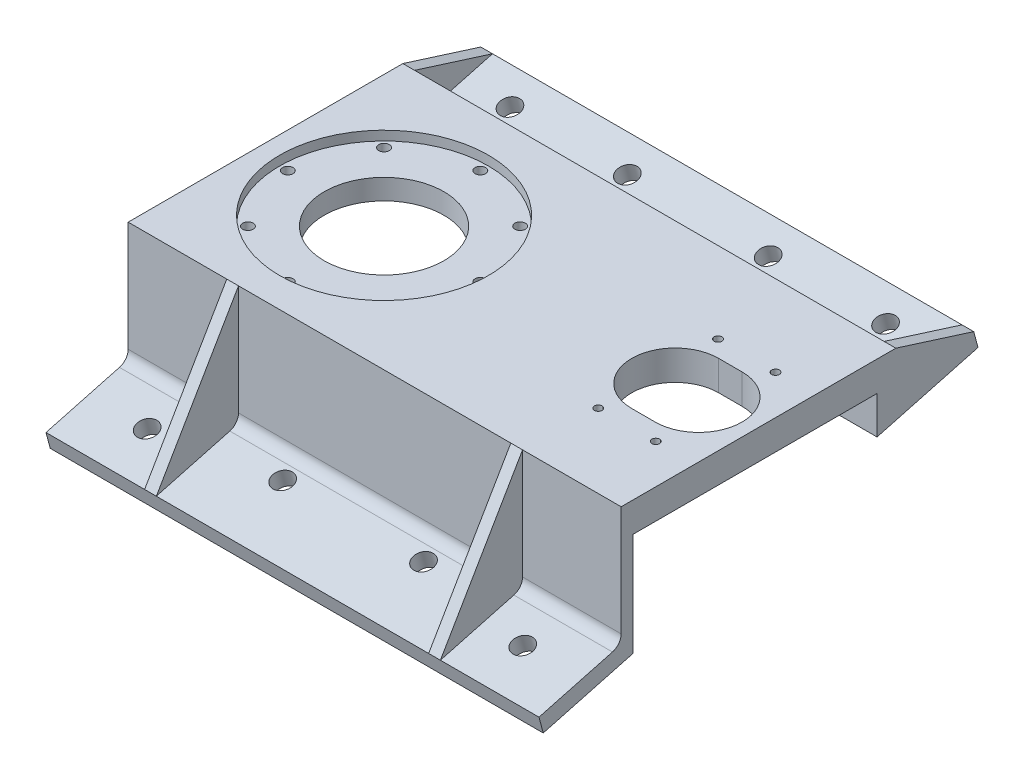
from build123d import *

# Parameters (mm, degrees)
EXTRUDE_1_DEPTH      = 30
SKETCH_2_R           = 44.45
CUT_EXTRUDE_1_DEPTH  = 4
SKETCH_3_R           = 25.5
SKETCH_3_R_2         = 2.25
CUT_EXTRUDE_2_DEPTH  = 188.619295383
CUT_EXTRUDE_3_DEPTH  = 189.215302247
SKETCH_5_R           = 1.65
CUT_EXTRUDE_4_DEPTH  = 189.215302247
EXTRUDE_START        = -30
EXTRUDE_2_DEPTH      = 30
CUT_EXTRUDE_5_DEPTH  = 198.040604952
CUT_EXTRUDE_7_DEPTH  = 233.432785983
CUT_EXTRUDE_8_DEPTH  = 233.432785983
CUT_EXTRUDE_9_DEPTH  = 233.432785983
FILLET_1_R           = 5
CUT_EXTRUDE_10_DEPTH = 233.432785983
EXTRUDE_START_2      = -5
EXTRUDE_3_DEPTH      = 5
EXTRUDE_4_DEPTH      = 5
SKETCH_14_R          = 4.25
CUT_EXTRUDE_11_DEPTH = 189.364728478
SKETCH_16_W          = 43
SKETCH_16_H          = 30
CUT_EXTRUDE_12_DEPTH = 233.432785983
EXTRUDE_7_REACH      = 188.592
SKETCH_18_W          = 210
SKETCH_18_H          = 5
EXTRUDE_8_DEPTH      = 210
EXTRUDE_9_DEPTH      = 5
EXTRUDE_10_DEPTH     = 5
SKETCH_22_R          = 4.25
CUT_EXTRUDE_13_DEPTH = 187.984035343
FILLET_2_R           = 5
EXTRUDE_11_DEPTH     = 2.5
EXTRUDE_12_DEPTH     = 2.5
CUT_EXTRUDE_15_DEPTH = 5
CUT_EXTRUDE_START    = -5
CUT_EXTRUDE_16_DEPTH = 5


with BuildPart() as part:
    # 草图1 → 凸台-拉伸1 (new body)
    with BuildSketch(Plane(origin=(0, 0, 0), x_dir=(1, 0, 0), z_dir=(0, 1, 0))):
        with BuildLine():
            Line((170, 31.93), (170, -31.93))
            ThreePointArc((170, -31.93), (167.781993847, -38.210172909), (162.111885646, -41.704453387))
            Line((162.111885646, -41.704453387), (15.839142344, -73.308400404))
            ThreePointArc((15.839142344, -73.308400404), (-75, 0), (15.839142344, 73.308400404))
            Line((15.839142344, 73.308400404), (162.111885646, 41.704453387))
            ThreePointArc((162.111885646, 41.704453387), (167.781993847, 38.210172909), (170, 31.93))
        make_face()
    extrude(amount=EXTRUDE_1_DEPTH)

    # 草图2 → 切除-拉伸1 (cut)
    with BuildSketch(Plane(origin=(0, 30, 0), x_dir=(1, 0, 0), z_dir=(0, 1, 0))):
        with Locations(Location((0, 0, 0), (0, 0, 270))):
            Circle(SKETCH_2_R)
    extrude(amount=-CUT_EXTRUDE_1_DEPTH, mode=Mode.SUBTRACT)

    # 草图3 → 切除-拉伸2 (cut, through all)
    with BuildSketch(Plane(origin=(0, 26, 0), x_dir=(1, 0, 0), z_dir=(0, 1, 0))):
        with Locations(Location((0, 0, 0), (0, 0, 270))):
            Circle(SKETCH_3_R)
        with Locations(Location((0, 41, 0), (0, 0, 270))):
            Circle(SKETCH_3_R_2)
        with Locations(Location((28.991378029, 28.991378029, 0), (0, 0, 270))):
            Circle(SKETCH_3_R_2)
        with Locations(Location((41, 0, 0), (0, 0, 270))):
            Circle(SKETCH_3_R_2)
        with Locations(Location((28.991378029, -28.991378029, 0), (0, 0, 270))):
            Circle(SKETCH_3_R_2)
        with Locations(Location((0, -41, 0), (0, 0, 270))):
            Circle(SKETCH_3_R_2)
        with Locations(Location((-28.991378029, -28.991378029, 0), (0, 0, 270))):
            Circle(SKETCH_3_R_2)
        with Locations(Location((-41, 0, 0), (0, 0, 270))):
            Circle(SKETCH_3_R_2)
        with Locations(Location((-28.991378029, 28.991378029, 0), (0, 0, 270))):
            Circle(SKETCH_3_R_2)
    extrude(amount=-CUT_EXTRUDE_2_DEPTH, mode=Mode.SUBTRACT)

    # 草图4 → 切除-拉伸3 (cut, through all)
    with BuildSketch(Plane(origin=(0, 30, 0), x_dir=(1, 0, 0), z_dir=(0, 1, 0))):
        with BuildLine():
            Line((124, 18.5), (134, 18.5))
            ThreePointArc((134, 18.5), (152.5, 0), (134, -18.5))
            Line((134, -18.5), (124, -18.5))
            ThreePointArc((124, -18.5), (105.5, 0), (124, 18.5))
        make_face()
    extrude(amount=-CUT_EXTRUDE_3_DEPTH, mode=Mode.SUBTRACT)

    # 草图5 → 切除-拉伸4 (cut, through all)
    with BuildSketch(Plane(origin=(0, 30, 0), x_dir=(1, 0, 0), z_dir=(0, 1, 0))):
        with Locations(Location((116.75, 25.5, 0), (0, 0, 270))):
            Circle(SKETCH_5_R)
        with Locations(Location((141.25, 25.5, 0), (0, 0, 270))):
            Circle(SKETCH_5_R)
        with Locations(Location((141.25, -25.5, 0), (0, 0, 270))):
            Circle(SKETCH_5_R)
        with Locations(Location((116.75, -25.5, 0), (0, 0, 270))):
            Circle(SKETCH_5_R)
    extrude(amount=-CUT_EXTRUDE_4_DEPTH, mode=Mode.SUBTRACT)

    # 草图6 → 凸台-拉伸2 (add)
    with BuildSketch(Plane(origin=(0, 30, 0), x_dir=(1, 0, 0), z_dir=(0, 1, 0)).offset(EXTRUDE_START)):
        with BuildLine():
            Line((158, 95), (-52, 95))
            Line((-52, 95), (-52, 54.046276467))
            ThreePointArc((-52, 54.046276467), (-20.48558667, 72.148047366), (15.839142344, 73.308400404))
            Line((15.839142344, 73.308400404), (158, 42.592874655))
            Line((158, 42.592874655), (158, 95))
        make_face()
        with BuildLine():
            ThreePointArc((15.839142344, -73.308400404), (-20.48558667, -72.148047366), (-52, -54.046276467))
            Line((-52, -54.046276467), (-52, -95))
            Line((-52, -95), (158, -95))
            Line((158, -95), (158, -42.592874655))
            Line((158, -42.592874655), (15.839142344, -73.308400404))
        make_face()
    extrude(amount=EXTRUDE_2_DEPTH)

    # 草图7 → 切除-拉伸5 (cut, through all)
    with BuildSketch(Plane(origin=(0, 30, 0), x_dir=(1, 0, 0), z_dir=(0, 1, 0))):
        with BuildLine():
            Line((-52, 54.046276467), (-52, -54.046276467))
            ThreePointArc((-52, -54.046276467), (-75, 0), (-52, 54.046276467))
        make_face()
        with BuildLine():
            Line((158, 42.592874655), (158, -42.592874655))
            Line((158, -42.592874655), (162.111885646, -41.704453387))
            ThreePointArc((162.111885646, -41.704453387), (167.781993847, -38.210172909), (170, -31.93))
            Line((170, -31.93), (170, 31.93))
            ThreePointArc((170, 31.93), (167.781993847, 38.210172909), (162.111885646, 41.704453387))
            Line((162.111885646, 41.704453387), (158, 42.592874655))
        make_face()
    extrude(amount=-CUT_EXTRUDE_5_DEPTH, mode=Mode.SUBTRACT)

    # 草图9 → 切除-拉伸7 (cut, through all)
    with BuildSketch(Plane.ZY.offset(52)):
        Polygon((-95, 20), (-60, 10.621778265), (-60, 30), (-95, 30), align=None)
    extrude(amount=-CUT_EXTRUDE_7_DEPTH, mode=Mode.SUBTRACT)

    # 草图10 → 切除-拉伸8 (cut, through all)
    with BuildSketch(Plane.ZY.offset(52)):
        Polygon((-95, 12.753066737), (-52, 1.231251463), (-52, 0), (-95, 0), align=None)
    extrude(amount=-CUT_EXTRUDE_8_DEPTH, mode=Mode.SUBTRACT)

    # 草图8 → 切除-拉伸9 (cut, through all)
    with BuildSketch(Plane.ZY.offset(52)):
        Polygon((0, 0), (52, 0), (52, 17.3), (-52, 17.3), (-52, 0), align=None)
    extrude(amount=-CUT_EXTRUDE_9_DEPTH, mode=Mode.SUBTRACT)

    # 圆角1
    fillet_1_edges = [part.edges().sort_by_distance(p)[0] for p in [
        (53, 10.621778265, -60),
    ]]
    fillet(fillet_1_edges, radius=FILLET_1_R)

    # 草图11 → 切除-拉伸10 (cut, through all)
    with BuildSketch(Plane.ZY.offset(52)):
        Polygon((-95, 12.753066737), (-93.188266684, 19.514547521), (-95, 20), align=None)
    extrude(amount=-CUT_EXTRUDE_10_DEPTH, mode=Mode.SUBTRACT)

    # 草图12 → 凸台-拉伸3 (add)
    with BuildSketch(Plane.ZY.offset(52).offset(EXTRUDE_START_2)):
        with BuildLine():
            Line((-93.188266684, 19.514547521), (-60, 30))
            Line((-60, 30), (-60, 17.137905129))
            ThreePointArc((-60, 17.137905129), (-61.956192855, 13.171138428), (-66.294095226, 12.308275998))
            Line((-66.294095226, 12.308275998), (-93.188266684, 19.514547521))
        make_face()
    extrude(amount=EXTRUDE_3_DEPTH)

    # 草图13 → 凸台-拉伸4 (add)
    with BuildSketch(Plane(origin=(158, 0, 0), x_dir=(0, 0, -1), z_dir=(1, 0, 0))):
        with BuildLine():
            Line((66.294095226, 12.308275998), (93.188266684, 19.514547521))
            Line((93.188266684, 19.514547521), (60, 30))
            Line((60, 30), (60, 17.137905129))
            ThreePointArc((60, 17.137905129), (61.956192855, 13.171138428), (66.294095226, 12.308275998))
        make_face()
    extrude(amount=-EXTRUDE_4_DEPTH)

    # 草图14 → 切除-拉伸11 (cut, through all)
    with BuildSketch(Plane(origin=(0, -5.089745962, -1.36379332), x_dir=(1, 0, 0), z_dir=(0, 0.9659258262890681, 0.2588190451025214))):
        with Locations(Location((-27, 82.063690052, 0), (0, 0, 270))):
            Circle(SKETCH_14_R)
        with Locations(Location((23, 82.063690052, 0), (0, 0, 270))):
            Circle(SKETCH_14_R)
        with Locations(Location((83, 82.063690052, 0), (0, 0, 270))):
            Circle(SKETCH_14_R)
        with Locations(Location((133, 82.063690052, 0), (0, 0, 270))):
            Circle(SKETCH_14_R)
    extrude(amount=-CUT_EXTRUDE_11_DEPTH, mode=Mode.SUBTRACT)

    # 草图16 → 切除-拉伸12 (cut, through all)
    with BuildSketch(Plane.ZY.offset(52)):
        with Locations((73.5, 15)):
            Rectangle(SKETCH_16_W, SKETCH_16_H)
    extrude(amount=-CUT_EXTRUDE_12_DEPTH, mode=Mode.SUBTRACT)

    # 凸台-拉伸7: up to this plane
    extrude_7_end = Plane(origin=(0, -11.851226746, -3.175526636), z_dir=(0, -0.9659258262890681, -0.25881904510252146))
    # 草图18 → 凸台-拉伸7 (add, up to the surface)
    with BuildSketch(Plane(origin=(0, 30, 0), x_dir=(1, 0, 0), z_dir=(0, 1, 0)), mode=Mode.PRIVATE) as extrude_7_sk1:
        with Locations((53, -54.5)):
            Rectangle(SKETCH_18_W, SKETCH_18_H)
    extrude_7_tool1 = split(extrude(extrude_7_sk1.sketch, amount=-EXTRUDE_7_REACH, mode=Mode.PRIVATE), bisect_by=extrude_7_end, keep=Keep.BOTH, mode=Mode.PRIVATE)
    add(extrude_7_tool1.solids().sort_by_distance((53, 30, 54.5))[0])

    # 草图19 → 凸台-拉伸8 (add)
    with BuildSketch(Plane.ZY.offset(52)):
        Polygon((57, -27.975210512), (90.188266684, -36.867979769), (92, -30.106498985), (57, -20.72827725), align=None)
    extrude(amount=-EXTRUDE_8_DEPTH)

    # 草图20 → 凸台-拉伸9 (add)
    with BuildSketch(Plane.ZY.offset(52)):
        Polygon((92, -30.106498985), (57, -20.72827725), (57, 30), align=None)
    extrude(amount=-EXTRUDE_9_DEPTH)

    # 草图21 → 凸台-拉伸10 (add)
    with BuildSketch(Plane(origin=(158, 0, 0), x_dir=(0, 0, -1), z_dir=(1, 0, 0))):
        Polygon((-57, 30), (-92, -30.106498985), (-57, -20.72827725), align=None)
    extrude(amount=-EXTRUDE_10_DEPTH)

    # 草图22 → 切除-拉伸13 (cut, through all)
    with BuildSketch(Plane(origin=(0, -5.089745962, -1.36379332), x_dir=(1, 0, 0), z_dir=(0, 0.9659258262890686, 0.25881904510251946))):
        with Locations(Location((-27, -77.936309948, 0), (0, 0, 270))):
            Circle(SKETCH_22_R)
        with Locations(Location((23, -69.936309948, 0), (0, 0, 270))):
            Circle(SKETCH_22_R)
        with Locations(Location((83, -69.936309948, 0), (0, 0, 270))):
            Circle(SKETCH_22_R)
        with Locations(Location((133, -77.936309948, 0), (0, 0, 270))):
            Circle(SKETCH_22_R)
    extrude(amount=-CUT_EXTRUDE_13_DEPTH, mode=Mode.SUBTRACT)

    # 圆角2
    fillet_2_edges = [part.edges().sort_by_distance(p)[0] for p in [
        (53, -20.72827725, 57),
    ]]
    fillet(fillet_2_edges, radius=FILLET_2_R)

    # 草图25 → 凸台-拉伸11 (add, symmetric)
    with BuildSketch(Plane.ZY.offset(7.5)):
        with BuildLine():
            Line((60.705904774, -21.721271441), (92, -30.106498985))
            Line((92, -30.106498985), (57, 30))
            Line((57, 30), (57, -16.89164231))
            ThreePointArc((57, -16.89164231), (58.033233299, -19.935449455), (60.705904774, -21.721271441))
        make_face()
    extrude(amount=EXTRUDE_11_DEPTH, both=True)

    # 草图26 → 凸台-拉伸12 (add, symmetric)
    with BuildSketch(Plane(origin=(113.5, 0, 0), x_dir=(0, 0, -1), z_dir=(1, 0, 0))):
        with BuildLine():
            Line((-57, -16.89164231), (-57, 30))
            Line((-57, 30), (-92, -30.106498985))
            Line((-92, -30.106498985), (-60.705904774, -21.721271441))
            ThreePointArc((-60.705904774, -21.721271441), (-58.033233299, -19.935449455), (-57, -16.89164231))
        make_face()
    extrude(amount=EXTRUDE_12_DEPTH, both=True)

    # 草图27 → 切除-拉伸15 (cut)
    with BuildSketch(Plane(origin=(-47, 0, 0), x_dir=(0, 0, -1), z_dir=(1, 0, 0))):
        with BuildLine():
            Line((-92, -30.106498985), (-60.705904774, -21.721271441))
            ThreePointArc((-60.705904774, -21.721271441), (-58.033233299, -19.935449455), (-57, -16.89164231))
            Line((-57, -16.89164231), (-57, 30))
            Line((-57, 30), (-92, -30.106498985))
        make_face()
    extrude(amount=-CUT_EXTRUDE_15_DEPTH, mode=Mode.SUBTRACT)

    # 草图28 → 切除-拉伸16 (cut)
    with BuildSketch(Plane.ZY.offset(-153).offset(CUT_EXTRUDE_START)):
        with BuildLine():
            Line((57, 30), (57, -16.89164231))
            ThreePointArc((57, -16.89164231), (58.033233299, -19.935449455), (60.705904774, -21.721271441))
            Line((60.705904774, -21.721271441), (92, -30.106498985))
            Line((92, -30.106498985), (57, 30))
        make_face()
    extrude(amount=CUT_EXTRUDE_16_DEPTH, mode=Mode.SUBTRACT)


solid = part.part
